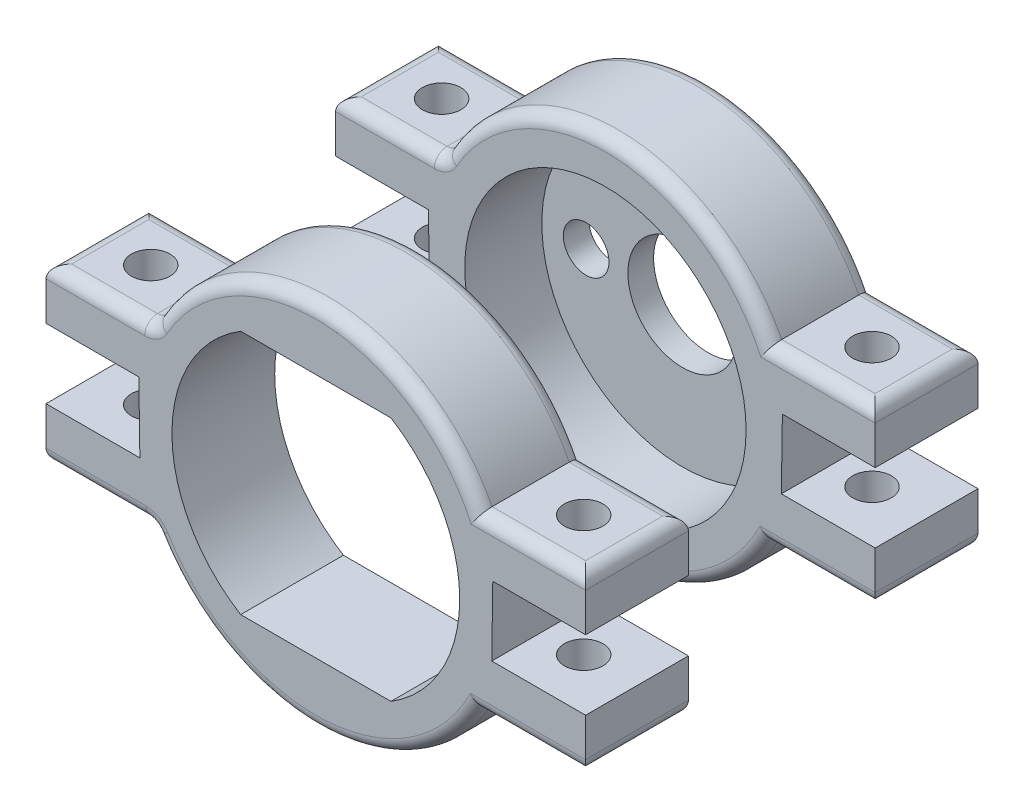
from build123d import *

# Parameters (mm, degrees)
SALIENTE_EXTRUIR1_DEPTH     = 8
CROQUIS2_R                  = 10.95
CORTAR_EXTRUIR1_DEPTH       = 6
CROQUIS3_R                  = 4.25
CROQUIS3_R_2                = 1.775
CORTAR_EXTRUIR2_DEPTH       = 3.5
SALIENTE_EXTRUIR3_DEPTH     = 8
CORTAR_EXTRUIR8_DEPTH       = 10
CORTAR_EXTRUIR9_DEPTH       = 45.115087908
CORTAR_EXTRUIR9_DEPTH_BACK  = 45.115087908
CROQUIS11_W                 = 3
CROQUIS11_H                 = 31
CROQUIS11_H_2               = 30.54
CORTAR_EXTRUIR10_DEPTH      = 43.557502055
CORTAR_EXTRUIR10_DEPTH_BACK = 43.557502055
CROQUIS8_R                  = 1.5
REDONDEO1_R                 = 1
REDONDEO2_R                 = 1
CORTAR_EXTRUIR11_DEPTH      = 40.766031359


with BuildPart() as part:
    # Croquis1 → Saliente-Extruir1 (new body)
    with BuildSketch(Plane.XY):
        with BuildLine():
            Line((-13.774000535, 2.505376075), (-23.904880159, 2.505376075))
            Line((-23.904880159, 2.505376075), (-23.904880159, 6.505376075))
            Line((-23.904880159, 6.505376075), (-12.724884059, 6.505376075))
            ThreePointArc((-12.724884059, 6.505376075), (0, 14.291346759), (12.724884059, 6.505376075))
            Line((12.724884059, 6.505376075), (23.904880159, 6.505376075))
            Line((23.904880159, 6.505376075), (23.904000535, 2.505376075))
            Line((23.904000535, 2.505376075), (13.774000535, 2.505376075))
            ThreePointArc((13.774000535, 2.505376075), (13.998482492, -0.206125965), (13.694262089, -2.909842925))
            Line((13.694262089, -2.909842925), (23.825141713, -2.909842925))
            Line((23.825141713, -2.909842925), (23.825141713, -6.909842925))
            Line((23.825141713, -6.909842925), (12.645145613, -6.909842925))
            ThreePointArc((12.645145613, -6.909842925), (0, -14.409914532), (-12.645145613, -6.909842925))
            Line((-12.645145613, -6.909842925), (-23.825141713, -6.909842925))
            Line((-23.825141713, -6.909842925), (-23.825141713, -2.909842925))
            Line((-23.825141713, -2.909842925), (-13.694262089, -2.909842925))
            ThreePointArc((-13.694262089, -2.909842925), (-13.998482492, -0.206125965), (-13.774000535, 2.505376075))
        make_face()
    extrude(amount=SALIENTE_EXTRUIR1_DEPTH)

    # Croquis2 → Cortar-Extruir1 (cut)
    with BuildSketch(Plane.XY.offset(8)):
        Circle(CROQUIS2_R)
    extrude(amount=-CORTAR_EXTRUIR1_DEPTH, mode=Mode.SUBTRACT)

    # Croquis3 → Cortar-Extruir2 (cut)
    with BuildSketch(Plane.XY.offset(2)):
        Circle(CROQUIS3_R)
        with Locations((-7.5, 0)):
            Circle(CROQUIS3_R_2)
        with Locations((7.5, 0)):
            Circle(CROQUIS3_R_2)
    extrude(amount=-CORTAR_EXTRUIR2_DEPTH, mode=Mode.SUBTRACT)


with BuildPart() as body_2:
    # Croquis6 → Saliente-Extruir3 (new body)
    with BuildSketch(Plane.XY.offset(22.54)):
        with BuildLine():
            Line((-12.724884059, 6.505376075), (-24, 6.505376075))
            Line((-24, 6.505376075), (-24, 2.505376075))
            Line((-24, 2.505376075), (-13.774000535, 2.505376075))
            ThreePointArc((-13.774000535, 2.505376075), (-13.998482492, -0.206125965), (-13.694262089, -2.909842925))
            Line((-13.694262089, -2.909842925), (-23.825141713, -2.909842925))
            Line((-23.825141713, -2.909842925), (-23.825141713, -6.909842925))
            Line((-23.825141713, -6.909842925), (-12.645145613, -6.909842925))
            ThreePointArc((-12.645145613, -6.909842925), (0, -14.409914532), (12.645145613, -6.909842925))
            Line((12.645145613, -6.909842925), (23.825141713, -6.909842925))
            Line((23.825141713, -6.909842925), (23.825141713, -2.909842925))
            Line((23.825141713, -2.909842925), (13.694262089, -2.909842925))
            ThreePointArc((13.694262089, -2.909842925), (13.998518056, -0.203696426), (13.773130053, 2.510157075))
            Line((13.773130053, 2.510157075), (24, 2.510157075))
            Line((24, 2.510157075), (24, 6.510157075))
            Line((24, 6.510157075), (12.722438722, 6.510157075))
            ThreePointArc((12.722438722, 6.510157075), (-0.002685034, 14.291346507), (-12.724884059, 6.505376075))
        make_face()
    extrude(amount=SALIENTE_EXTRUIR3_DEPTH)

    # Croquis7 → Cortar-Extruir8 (cut)
    with BuildSketch(Plane.XY.offset(30.54)):
        with BuildLine():
            Line((-5.848709946, 9.551575366), (5.848709946, 9.551575366))
            ThreePointArc((5.848709946, 9.551575366), (11.2, 0), (5.848709946, -9.551575366))
            Line((5.848709946, -9.551575366), (-5.848709946, -9.551575366))
            ThreePointArc((-5.848709946, -9.551575366), (-11.2, 0), (-5.848709946, 9.551575366))
        make_face()
    extrude(amount=-CORTAR_EXTRUIR8_DEPTH, mode=Mode.SUBTRACT)


with BuildPart() as cortar_extruir9_tool:
    # Croquis11 → Cortar-Extruir9 (new, two sides: drawn at the far end of the back side and taken through both)
    with BuildSketch(Plane(origin=(0, 6.505376075, 0), x_dir=(1, 0, 0), z_dir=(0, 1, 0)).offset(-CORTAR_EXTRUIR9_DEPTH_BACK)):
        with Locations((22.5, -15.5)):
            Rectangle(CROQUIS11_W, CROQUIS11_H)
        with Locations((-22.5, -15.27)):
            Rectangle(CROQUIS11_W, CROQUIS11_H_2)
    extrude(amount=CORTAR_EXTRUIR9_DEPTH + CORTAR_EXTRUIR9_DEPTH_BACK)


with BuildPart() as part_1:
    add(part.part)

    # Cortar-Extruir9: cut by cortar_extruir9_tool
    add(cortar_extruir9_tool.part, mode=Mode.SUBTRACT)


with BuildPart() as body_2_1:
    add(body_2.part)

    # Cortar-Extruir9: cut by cortar_extruir9_tool
    add(cortar_extruir9_tool.part, mode=Mode.SUBTRACT)


with BuildPart() as cortar_extruir10_tool:
    # Croquis8 → Cortar-Extruir10 (new, two sides: drawn at the far end of the back side and taken through both)
    with BuildSketch(Plane(origin=(0, 6.505376075, 0), x_dir=(1, 0, 0), z_dir=(0, 1, 0)).offset(-CORTAR_EXTRUIR10_DEPTH_BACK)):
        with Locations(Location((16.85, -26.54, 0), (0, 0, 180))):
            Circle(CROQUIS8_R)
        with Locations(Location((16.750107191, -4, 0), (0, 0, 180))):
            Circle(CROQUIS8_R)
        with Locations(Location((-16.750107191, -4, 0), (0, 0, 180))):
            Circle(CROQUIS8_R)
        with Locations(Location((-16.85, -26.54, 0), (0, 0, 180))):
            Circle(CROQUIS8_R)
    extrude(amount=CORTAR_EXTRUIR10_DEPTH + CORTAR_EXTRUIR10_DEPTH_BACK)


with BuildPart() as part_2:
    add(part_1.part)

    # Cortar-Extruir10: cut by cortar_extruir10_tool
    add(cortar_extruir10_tool.part, mode=Mode.SUBTRACT)

    # Redondeo1
    redondeo1_edges = [part_2.edges().sort_by_distance(p)[0] for p in [
        (16.822572806, -6.909842925, 0),
        (0, -14.409914532, 0),
        (-16.862442029, 6.505376075, 0),
        (0, 14.291346759, 0),
        (-12.645145613, -6.909842925, 4),
        (-12.724884059, 6.505376075, 4),
        (0, -14.409914532, 8),
        (16.822572806, -6.909842925, 8),
        (0, 14.291346759, 8),
        (16.862442029, 6.505376075, 0),
        (-16.822572806, -6.909842925, 0),
        (-16.862442029, 6.505376075, 8),
        (-16.822572806, -6.909842925, 8),
        (16.862442029, 6.505376075, 8),
        (-21, -6.909842925, 4),
        (-21, 6.505376075, 4),
        (21, 6.505376075, 4),
        (21, -6.909842925, 4),
    ]]
    fillet(redondeo1_edges, radius=REDONDEO1_R)


with BuildPart() as body_2_2:
    add(body_2_1.part)

    # Cortar-Extruir10: cut by cortar_extruir10_tool
    add(cortar_extruir10_tool.part, mode=Mode.SUBTRACT)

    # Redondeo2
    redondeo2_edges = [body_2_2.edges().sort_by_distance(p)[0] for p in [
        (16.822572806, -6.909842925, 22.54),
        (0, -14.409914532, 22.54),
        (-16.862442029, 6.505376075, 22.54),
        (-0.002685034, 14.291346507, 22.54),
        (-12.645145613, -6.909842925, 26.54),
        (-12.724884059, 6.505376075, 26.54),
        (0, -14.409914532, 30.54),
        (16.822572806, -6.909842925, 30.54),
        (-0.002685034, 14.291346507, 30.54),
        (16.861219361, 6.510157075, 22.54),
        (-16.822572806, -6.909842925, 22.54),
        (-16.862442029, 6.505376075, 30.54),
        (-16.822572806, -6.909842925, 30.54),
        (16.861219361, 6.510157075, 30.54),
        (-21, -6.909842925, 26.54),
        (-21, 6.505376075, 26.54),
        (21, 6.510157075, 26.54),
        (21, -6.909842925, 26.54),
    ]]
    fillet(redondeo2_edges, radius=REDONDEO2_R)


with BuildPart() as cortar_extruir11_tool:
    # Croquis12 → Cortar-Extruir11 (new, through all)
    with BuildSketch(Plane(origin=(0, 0, 0), x_dir=(-1, 0, 0), z_dir=(0, 0, -1))):
        with BuildLine():
            Line((-13.774000535, 2.505376075), (-13.694262089, -2.909842925))
            ThreePointArc((-13.694262089, -2.909842925), (-13.998482492, -0.206125965), (-13.774000535, 2.505376075))
        make_face()
        with BuildLine():
            Line((13.774000535, 2.505376075), (13.694262089, -2.909842925))
            ThreePointArc((13.694262089, -2.909842925), (13.998482492, -0.206125965), (13.774000535, 2.505376075))
        make_face()
    extrude(amount=-CORTAR_EXTRUIR11_DEPTH)


with BuildPart() as part_3:
    add(part_2.part)

    # Cortar-Extruir11: cut by cortar_extruir11_tool
    add(cortar_extruir11_tool.part, mode=Mode.SUBTRACT)


with BuildPart() as body_2_3:
    add(body_2_2.part)

    # Cortar-Extruir11: cut by cortar_extruir11_tool
    add(cortar_extruir11_tool.part, mode=Mode.SUBTRACT)


solid = Compound([part_3.part, body_2_3.part])
